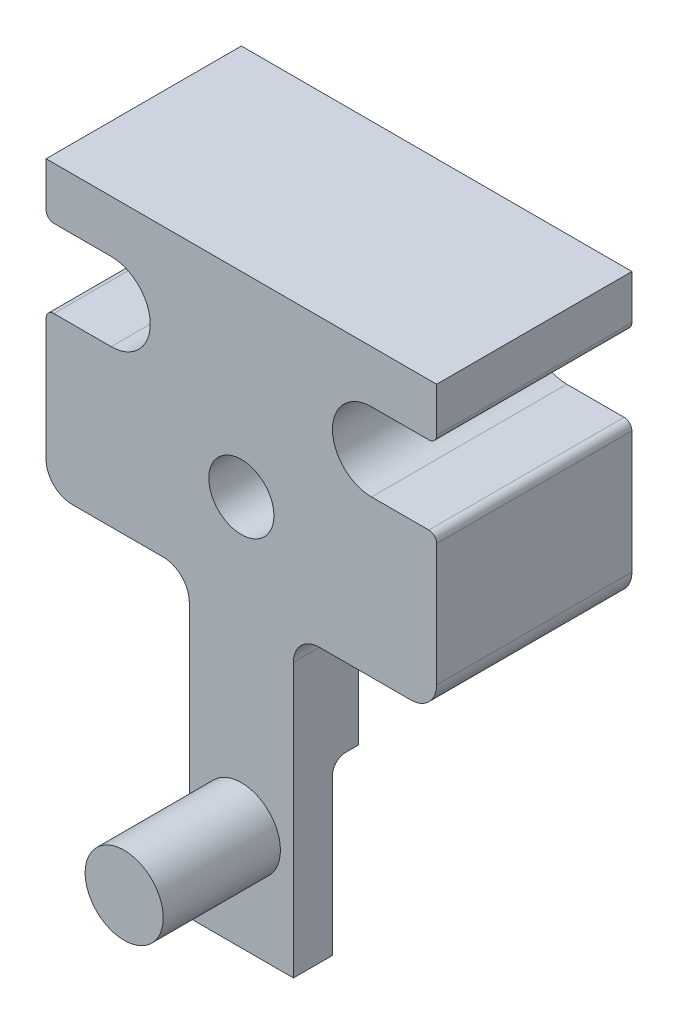
from build123d import *

# Parameters (mm, degrees)
EXTRUDE_1_DEPTH      = 7.5
FILLET_1_R           = 0.3
FILLET_2_R           = 1
HOLE_WIZARD_M3_1_D   = 2.5
SKETCH_4_W           = 4
SKETCH_4_H           = 5
EXTRUDE_2_DEPTH      = 2.5
SKETCH_5_W           = 4
SKETCH_5_H           = 6.5
EXTRUDE_3_DEPTH      = 1.5
FILLET_3_R           = 0.5
EXTRUDE_4_DEPTH      = 1
EXTRUDE_4_DEPTH_BACK = 1
FILLET_4_R           = 1
SKETCH_7_R           = 1.5
EXTRUDE_5_DEPTH      = 4.5


with BuildPart() as part:
    # 草图1 → 凸台-拉伸1 (new body)
    with BuildSketch(Plane.XY):
        with BuildLine():
            Line((-7.5, 0.5), (-7.5, -5.5))
            Line((-7.5, -5.5), (7.5, -5.5))
            Line((7.5, -5.5), (7.5, 0.5))
            Line((7.5, 0.5), (5, 0.5))
            ThreePointArc((5, 0.5), (3.5, 2), (5, 3.5))
            Line((5, 3.5), (7.5, 3.5))
            Line((7.5, 3.5), (7.5, 5.5))
            Line((7.5, 5.5), (-7.5, 5.5))
            Line((-7.5, 5.5), (-7.5, 3.5))
            Line((-7.5, 3.5), (-5, 3.5))
            ThreePointArc((-5, 3.5), (-3.5, 2), (-5, 0.5))
            Line((-5, 0.5), (-7.5, 0.5))
        make_face()
    extrude(amount=EXTRUDE_1_DEPTH)

    # 圆角1
    fillet_1_edges = [part.edges().sort_by_distance(p)[0] for p in [
        (7.5, 0.5, 3.75),
        (-7.5, 0.5, 3.75),
        (-7.5, 3.5, 3.75),
        (7.5, 3.5, 3.75),
    ]]
    fillet(fillet_1_edges, radius=FILLET_1_R)

    # 圆角2
    fillet_2_edges = [part.edges().sort_by_distance(p)[0] for p in [
        (7.5, -5.5, 3.75),
        (-7.5, -5.5, 3.75),
    ]]
    fillet(fillet_2_edges, radius=FILLET_2_R)

    # M3 螺纹孔1 (through all)
    with Locations(Plane(origin=(0, -2, 7.5), x_dir=(1, 0, 0), z_dir=(0, 0, 1))):
        with Locations((0, 0)):
            Hole(HOLE_WIZARD_M3_1_D / 2)

    # 草图4 → 凸台-拉伸2 (add)
    with BuildSketch(Plane.XY.offset(7.5)):
        with Locations((0, -8)):
            Rectangle(SKETCH_4_W, SKETCH_4_H)
    extrude(amount=-EXTRUDE_2_DEPTH)

    # 草图5 → 凸台-拉伸3 (add)
    with BuildSketch(Plane.XY.offset(7.5)):
        with Locations((0, -13.75)):
            Rectangle(SKETCH_5_W, SKETCH_5_H)
    extrude(amount=-EXTRUDE_3_DEPTH)

    # 圆角3
    fillet_3_edges = [part.edges().sort_by_distance(p)[0] for p in [
        (0, -10.5, 6),
    ]]
    fillet(fillet_3_edges, radius=FILLET_3_R)

    # 草图6 → 凸台-拉伸4 (add, two sides: drawn at the far end of the back side and taken through both)
    with BuildSketch(Plane.ZY.offset(-EXTRUDE_4_DEPTH_BACK)):
        Polygon((5, -7), (3.5, -5.5), (5, -5.5), align=None)
    extrude(amount=EXTRUDE_4_DEPTH + EXTRUDE_4_DEPTH_BACK)

    # 圆角4
    fillet_4_edges = [part.edges().sort_by_distance(p)[0] for p in [
        (0, -7, 5),
        (0, -5.5, 3.5),
        (-2, -5.5, 6.25),
        (2, -5.5, 6.25),
    ]]
    fillet(fillet_4_edges, radius=FILLET_4_R)

    # 草图7 → 凸台-拉伸5 (add)
    with BuildSketch(Plane.XY.offset(7.5)):
        with Locations((0, -13)):
            Circle(SKETCH_7_R)
    extrude(amount=EXTRUDE_5_DEPTH)


solid = part.part
